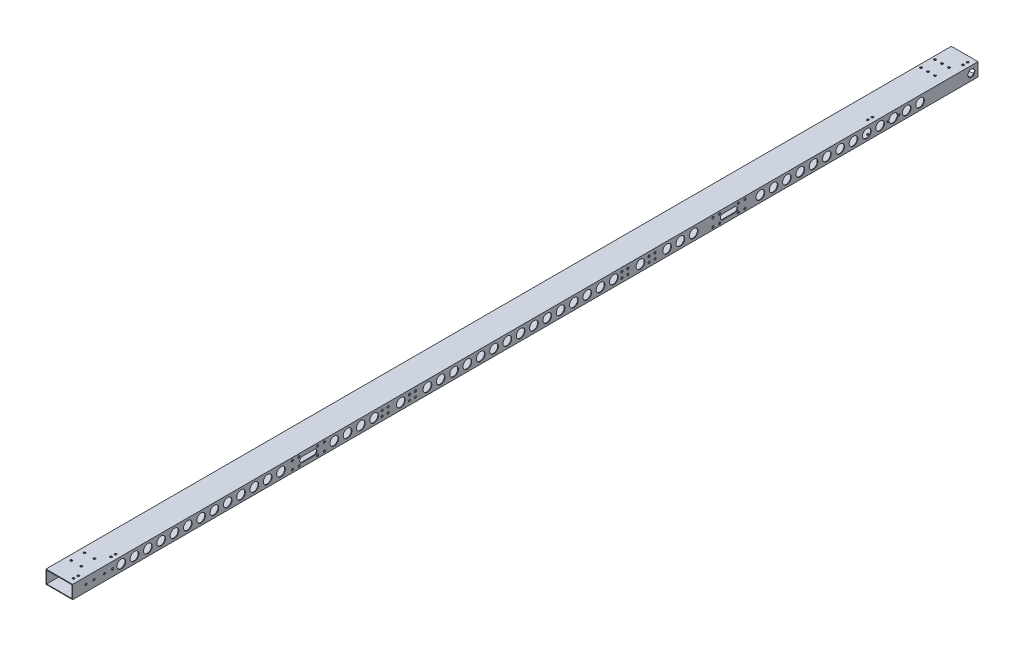
from build123d import *

# Parameters (mm, degrees)
SKETCH_1_W          = 40
SKETCH_1_H          = 20
SKETCH_1_W_2        = 38
SKETCH_1_H_2        = 18
EXTRUDE_1_DEPTH     = 1360
SKETCH_2_R          = 1.6
CUT_EXTRUDE_1_DEPTH = 1361.735095454
SKETCH_3_R          = 6.5
CUT_EXTRUDE_2_DEPTH = 1361.735095454
SKETCH_4_R          = 1.6
SKETCH_4_R_2        = 12
CUT_EXTRUDE_3_DEPTH = 1361.735095454
SKETCH_5_R          = 1.6
CUT_EXTRUDE_4_DEPTH = 1361.735095454


with BuildPart() as part:
    # 草图1 → 凸台-拉伸1 (new body)
    with BuildSketch(Plane.XY):
        with Locations((20, 10)):
            Rectangle(SKETCH_1_W, SKETCH_1_H)
        with Locations((20, 10)):
            Rectangle(SKETCH_1_W_2, SKETCH_1_H_2, mode=Mode.SUBTRACT)
    extrude(amount=EXTRUDE_1_DEPTH)

    # 草图2 → 切除-拉伸1 (cut, through all)
    with BuildSketch(Plane(origin=(40, 0, 0), x_dir=(0, 0, -1), z_dir=(1, 0, 0))):
        with Locations((-526, 14)):
            Circle(SKETCH_2_R)
        with Locations((-526, 6)):
            Circle(SKETCH_2_R)
        with Locations((-535, 14)):
            Circle(SKETCH_2_R)
        with Locations((-535, 6)):
            Circle(SKETCH_2_R)
        with Locations((-494, 14)):
            Circle(SKETCH_2_R)
        with Locations((-494, 6)):
            Circle(SKETCH_2_R)
        with Locations((-485, 14)):
            Circle(SKETCH_2_R)
        with Locations((-485, 6)):
            Circle(SKETCH_2_R)
        with Locations((-886, 14)):
            Circle(SKETCH_2_R)
        with Locations((-886, 6)):
            Circle(SKETCH_2_R)
        with Locations((-895, 14)):
            Circle(SKETCH_2_R)
        with Locations((-895, 6)):
            Circle(SKETCH_2_R)
        with Locations((-854, 14)):
            Circle(SKETCH_2_R)
        with Locations((-854, 6)):
            Circle(SKETCH_2_R)
        with Locations((-845, 14)):
            Circle(SKETCH_2_R)
        with Locations((-845, 6)):
            Circle(SKETCH_2_R)
        with Locations((-388.115427319, 16)):
            Circle(SKETCH_2_R)
        with Locations((-350.115427319, 4)):
            Circle(SKETCH_2_R)
        with Locations((-350.115427319, 16)):
            Circle(SKETCH_2_R)
        with Locations((-398.115427319, 4)):
            Circle(SKETCH_2_R)
        with Locations((-398.115427319, 16)):
            Circle(SKETCH_2_R)
        with Locations((-360.115427319, 4)):
            Circle(SKETCH_2_R)
        with Locations((-360.115427319, 16)):
            Circle(SKETCH_2_R)
        with Locations((-388.115427319, 4)):
            Circle(SKETCH_2_R)
        with Locations((-991.884572681, 16)):
            Circle(SKETCH_2_R)
        with Locations((-1029.884572681, 4)):
            Circle(SKETCH_2_R)
        with Locations((-1029.884572681, 16)):
            Circle(SKETCH_2_R)
        with Locations((-981.884572681, 4)):
            Circle(SKETCH_2_R)
        with Locations((-981.884572681, 16)):
            Circle(SKETCH_2_R)
        with Locations((-1019.884572681, 4)):
            Circle(SKETCH_2_R)
        with Locations((-1019.884572681, 16)):
            Circle(SKETCH_2_R)
        with Locations((-991.884572681, 4)):
            Circle(SKETCH_2_R)
        with BuildLine():
            Line((-365.115427319, 14), (-383.115427319, 14))
            ThreePointArc((-383.115427319, 14), (-387.115427319, 10), (-383.115427319, 6))
            Line((-383.115427319, 6), (-365.115427319, 6))
            ThreePointArc((-365.115427319, 6), (-361.115427319, 10), (-365.115427319, 14))
        make_face()
        with BuildLine():
            Line((-996.884572681, 14), (-1014.884572681, 14))
            ThreePointArc((-1014.884572681, 14), (-1018.884572681, 10), (-1014.884572681, 6))
            Line((-1014.884572681, 6), (-996.884572681, 6))
            ThreePointArc((-996.884572681, 6), (-992.884572681, 10), (-996.884572681, 14))
        make_face()
    extrude(amount=-CUT_EXTRUDE_1_DEPTH, mode=Mode.SUBTRACT)

    # 草图3 → 切除-拉伸2 (cut, through all)
    with BuildSketch(Plane(origin=(40, 0, 0), x_dir=(0, 0, -1), z_dir=(1, 0, 0))):
        with Locations((-1287, 10)):
            Circle(SKETCH_3_R)
        with Locations((-1267, 10)):
            Circle(SKETCH_3_R)
        with Locations((-1247, 10)):
            Circle(SKETCH_3_R)
        with Locations((-1227, 10)):
            Circle(SKETCH_3_R)
        with Locations((-1207, 10)):
            Circle(SKETCH_3_R)
        with Locations((-1187, 10)):
            Circle(SKETCH_3_R)
        with Locations((-1167, 10)):
            Circle(SKETCH_3_R)
        with Locations((-1147, 10)):
            Circle(SKETCH_3_R)
        with Locations((-1127, 10)):
            Circle(SKETCH_3_R)
        with Locations((-1107, 10)):
            Circle(SKETCH_3_R)
        with Locations((-1087, 10)):
            Circle(SKETCH_3_R)
        with Locations((-1067, 10)):
            Circle(SKETCH_3_R)
        with Locations((-1047, 10)):
            Circle(SKETCH_3_R)
        with Locations((-967, 10)):
            Circle(SKETCH_3_R)
        with Locations((-947, 10)):
            Circle(SKETCH_3_R)
        with Locations((-927, 10)):
            Circle(SKETCH_3_R)
        with Locations((-907, 10)):
            Circle(SKETCH_3_R)
        with Locations((-867, 10)):
            Circle(SKETCH_3_R)
        with Locations((-827, 10)):
            Circle(SKETCH_3_R)
        with Locations((-807, 10)):
            Circle(SKETCH_3_R)
        with Locations((-787, 10)):
            Circle(SKETCH_3_R)
        with Locations((-767, 10)):
            Circle(SKETCH_3_R)
        with Locations((-747, 10)):
            Circle(SKETCH_3_R)
        with Locations((-727, 10)):
            Circle(SKETCH_3_R)
        with Locations((-707, 10)):
            Circle(SKETCH_3_R)
        with Locations((-687, 10)):
            Circle(SKETCH_3_R)
        with Locations((-667, 10)):
            Circle(SKETCH_3_R)
        with Locations((-647, 10)):
            Circle(SKETCH_3_R)
        with Locations((-627, 10)):
            Circle(SKETCH_3_R)
        with Locations((-607, 10)):
            Circle(SKETCH_3_R)
        with Locations((-587, 10)):
            Circle(SKETCH_3_R)
        with Locations((-567, 10)):
            Circle(SKETCH_3_R)
        with Locations((-547, 10)):
            Circle(SKETCH_3_R)
        with Locations((-507, 10)):
            Circle(SKETCH_3_R)
        with Locations((-467, 10)):
            Circle(SKETCH_3_R)
        with Locations((-447, 10)):
            Circle(SKETCH_3_R)
        with Locations((-427, 10)):
            Circle(SKETCH_3_R)
        with Locations((-327, 10)):
            Circle(SKETCH_3_R)
        with Locations((-307, 10)):
            Circle(SKETCH_3_R)
        with Locations((-287, 10)):
            Circle(SKETCH_3_R)
        with Locations((-267, 10)):
            Circle(SKETCH_3_R)
        with Locations((-247, 10)):
            Circle(SKETCH_3_R)
        with Locations((-227, 10)):
            Circle(SKETCH_3_R)
        with Locations((-207, 10)):
            Circle(SKETCH_3_R)
        with Locations((-187, 10)):
            Circle(SKETCH_3_R)
        with Locations((-167, 10)):
            Circle(SKETCH_3_R)
        with Locations((-147, 10)):
            Circle(SKETCH_3_R)
        with Locations((-127, 10)):
            Circle(SKETCH_3_R)
        with Locations((-107, 10)):
            Circle(SKETCH_3_R)
        with Locations((-87, 10)):
            Circle(SKETCH_3_R)
        Polygon((-7.113248654, 15), (-12.886751346, 15), (-15.773502692, 10), (-12.886751346, 5), (-7.113248654, 5), (-4.226497308, 10), align=None)
    extrude(amount=-CUT_EXTRUDE_2_DEPTH, mode=Mode.SUBTRACT)

    # 草图4 → 切除-拉伸3 (cut, through all)
    with BuildSketch(Plane.XZ):
        with Locations((8, 1310)):
            Circle(SKETCH_4_R)
        with Locations((23, 1310)):
            Circle(SKETCH_4_R)
        with Locations((8, 1330)):
            Circle(SKETCH_4_R)
        with Locations((23, 1330)):
            Circle(SKETCH_4_R)
        with Locations((-30, 1320)):
            Circle(SKETCH_4_R_2)
        with Locations((26, 50.5)):
            Circle(SKETCH_4_R)
        with Locations((26, 29.5)):
            Circle(SKETCH_4_R)
        with Locations((5, 50.5)):
            Circle(SKETCH_4_R)
        with Locations((5, 29.5)):
            Circle(SKETCH_4_R)
        with Locations((15.5, 29.5)):
            Circle(SKETCH_4_R)
        with Locations((15.5, 50.5)):
            Circle(SKETCH_4_R)
        with Locations((33, 8.5)):
            Circle(SKETCH_4_R)
        with Locations((33, 15.5)):
            Circle(SKETCH_4_R)
        with Locations((33, 151.53681111)):
            Circle(SKETCH_4_R)
        with Locations((33, 158.53681111)):
            Circle(SKETCH_4_R)
        with Locations((33, 1288.5)):
            Circle(SKETCH_4_R)
        with Locations((33, 1295.5)):
            Circle(SKETCH_4_R)
        with Locations((33, 1344.5)):
            Circle(SKETCH_4_R)
        with Locations((33, 1351.5)):
            Circle(SKETCH_4_R)
    extrude(amount=-CUT_EXTRUDE_3_DEPTH, mode=Mode.SUBTRACT)

    # 草图5 → 切除-拉伸4 (cut, through all)
    with BuildSketch(Plane(origin=(40, 0, 0), x_dir=(0, 0, -1), z_dir=(1, 0, 0))):
        with Locations((-1300, 10)):
            Circle(SKETCH_5_R)
        with Locations((-1340, 10)):
            Circle(SKETCH_5_R)
        with Locations((-1312, 10)):
            Circle(SKETCH_5_R)
        with Locations((-1328, 10)):
            Circle(SKETCH_5_R)
        with Locations((-147.03681111, 10)):
            Circle(SKETCH_5_R)
        with Locations((-107.03681111, 10)):
            Circle(SKETCH_5_R)
        with Locations((-135.03681111, 10)):
            Circle(SKETCH_5_R)
        with Locations((-119.03681111, 10)):
            Circle(SKETCH_5_R)
    extrude(amount=-CUT_EXTRUDE_4_DEPTH, mode=Mode.SUBTRACT)


solid = part.part
